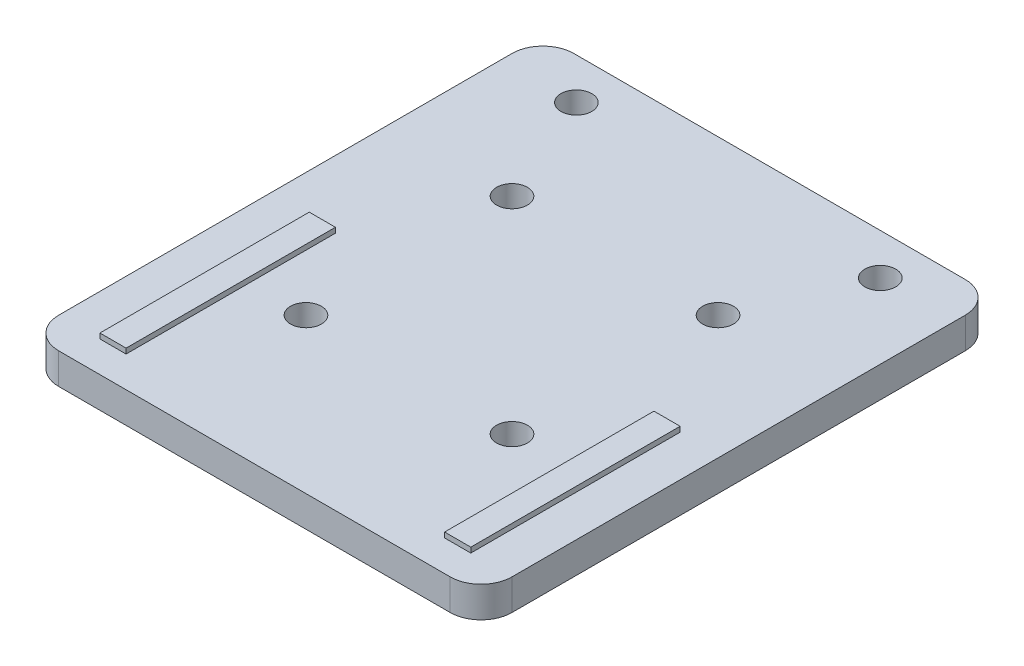
from build123d import *

# Parameters (mm, degrees)
SKETCH_1_W      = 44
SKETCH_1_H      = 50
SKETCH_1_R      = 1.5
EXTRUDE_1_DEPTH = 3
FILLET_1_R      = 3
SKETCH_2_W      = 2.54
SKETCH_2_H      = 20.32
EXTRUDE_2_DEPTH = 0.5


with BuildPart() as part:
    # 草图1 → 凸台-拉伸1 (new body)
    with BuildSketch(Plane(origin=(0, 0, 0), x_dir=(1, 0, 0), z_dir=(0, 1, 0))):
        Rectangle(SKETCH_1_W, SKETCH_1_H)
        with Locations(Location((-10, 10, 0), (0, 0, 270))):
            Circle(SKETCH_1_R, mode=Mode.SUBTRACT)
        with Locations(Location((10, 10, 0), (0, 0, 90))):
            Circle(SKETCH_1_R, mode=Mode.SUBTRACT)
        with Locations(Location((10, -10, 0), (0, 0, 270))):
            Circle(SKETCH_1_R, mode=Mode.SUBTRACT)
        with Locations(Location((-10, -10, 0), (0, 0, 90))):
            Circle(SKETCH_1_R, mode=Mode.SUBTRACT)
        with Locations(Location((-14.75, 21, 0), (0, 0, 270))):
            Circle(SKETCH_1_R, mode=Mode.SUBTRACT)
        with Locations(Location((14.75, 21, 0), (0, 0, 90))):
            Circle(SKETCH_1_R, mode=Mode.SUBTRACT)
    extrude(amount=EXTRUDE_1_DEPTH)

    # 圆角1
    fillet_1_edges = [part.edges().sort_by_distance(p)[0] for p in [
        (22, 1.5, 25),
        (-22, 1.5, 25),
        (-22, 1.5, -25),
        (22, 1.5, -25),
    ]]
    fillet(fillet_1_edges, radius=FILLET_1_R)

    # 草图2 → 凸台-拉伸2 (add)
    with BuildSketch(Plane(origin=(0, 3, 0), x_dir=(1, 0, 0), z_dir=(0, 1, 0))):
        with Locations((-16.73, -11.84)):
            Rectangle(SKETCH_2_W, SKETCH_2_H)
        with Locations((16.73, -11.84)):
            Rectangle(SKETCH_2_W, SKETCH_2_H)
    extrude(amount=EXTRUDE_2_DEPTH)


solid = part.part
